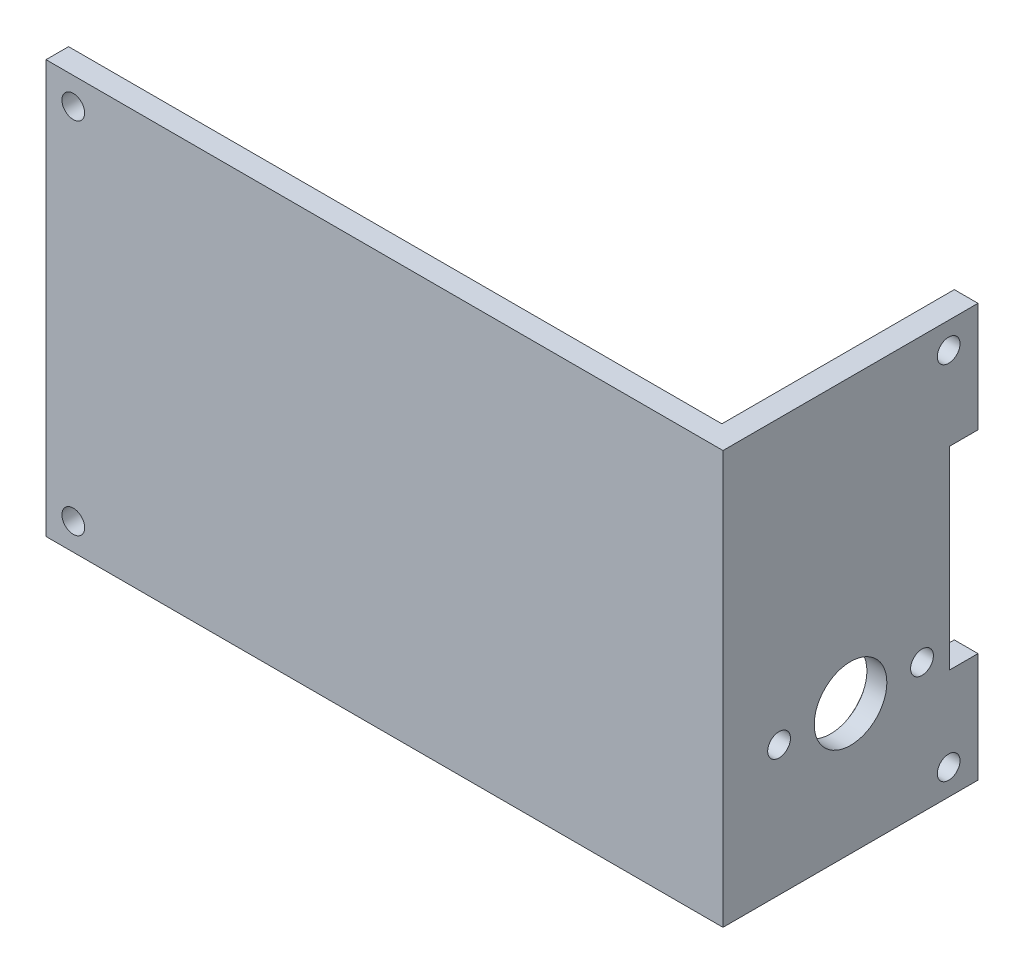
from build123d import *

# Parameters (mm, degrees)
BOSS_EXTRUDE1_DEPTH = 54.9
SKETCH2_R           = 1.51
CUT_EXTRUDE1_DEPTH  = 3.15
SKETCH3_R           = 1.51
CUT_EXTRUDE2_DEPTH  = 3
SKETCH4_R           = 4.826
SKETCH4_R_2         = 1.515
CUT_EXTRUDE3_DEPTH  = 3.15
SKETCH6_R           = 5.5
CUT_EXTRUDE5_DEPTH  = 0.5
SKETCH8_W           = 3.798879325
SKETCH8_H           = 25.75548204
CUT_EXTRUDE7_DEPTH  = 3.15


with BuildPart() as part:
    # Sketch1 → Boss-Extrude1 (new body)
    with BuildSketch(Plane(origin=(0, 0, 0), x_dir=(1, 0, 0), z_dir=(0, 1, 0))):
        Polygon((0, 0), (86.85, 0), (86.85, 30.9), (90, 30.9), (90, -3), (0, -3), align=None)
    extrude(amount=BOSS_EXTRUDE1_DEPTH)

    # Sketch2 → Cut-Extrude1 (cut)
    with BuildSketch(Plane(origin=(90, 0, 0), x_dir=(0, 0, -1), z_dir=(1, 0, 0))):
        with Locations((27, 51.45)):
            Circle(SKETCH2_R)
        with Locations((27, 3.45)):
            Circle(SKETCH2_R)
    extrude(amount=-CUT_EXTRUDE1_DEPTH, mode=Mode.SUBTRACT)

    # Sketch3 → Cut-Extrude2 (cut)
    with BuildSketch(Plane.XY.offset(3)):
        with Locations((3.625, 51.325)):
            Circle(SKETCH3_R)
        with Locations((3.625, 3.575)):
            Circle(SKETCH3_R)
    extrude(amount=-CUT_EXTRUDE2_DEPTH, mode=Mode.SUBTRACT)

    # Sketch4 → Cut-Extrude3 (cut)
    with BuildSketch(Plane(origin=(90, 0, 0), x_dir=(0, 0, -1), z_dir=(1, 0, 0))):
        with Locations((13.95544469, 17.3)):
            Circle(SKETCH4_R)
        with Locations((23.45544469, 17.3)):
            Circle(SKETCH4_R_2)
        with Locations((4.45544469, 17.3)):
            Circle(SKETCH4_R_2)
    extrude(amount=-CUT_EXTRUDE3_DEPTH, mode=Mode.SUBTRACT)

    # Sketch6 → Cut-Extrude5 (cut)
    with BuildSketch(Plane.ZY.offset(-86.85)):
        with Locations((-13.95544469, 17.3)):
            Circle(SKETCH6_R)
    extrude(amount=-CUT_EXTRUDE5_DEPTH, mode=Mode.SUBTRACT)

    # Sketch8 → Cut-Extrude7 (cut)
    with BuildSketch(Plane(origin=(90, 0, 0), x_dir=(0, 0, -1), z_dir=(1, 0, 0))):
        with Locations((29.000560338, 27.45)):
            Rectangle(SKETCH8_W, SKETCH8_H)
    extrude(amount=-CUT_EXTRUDE7_DEPTH, mode=Mode.SUBTRACT)


solid = part.part
